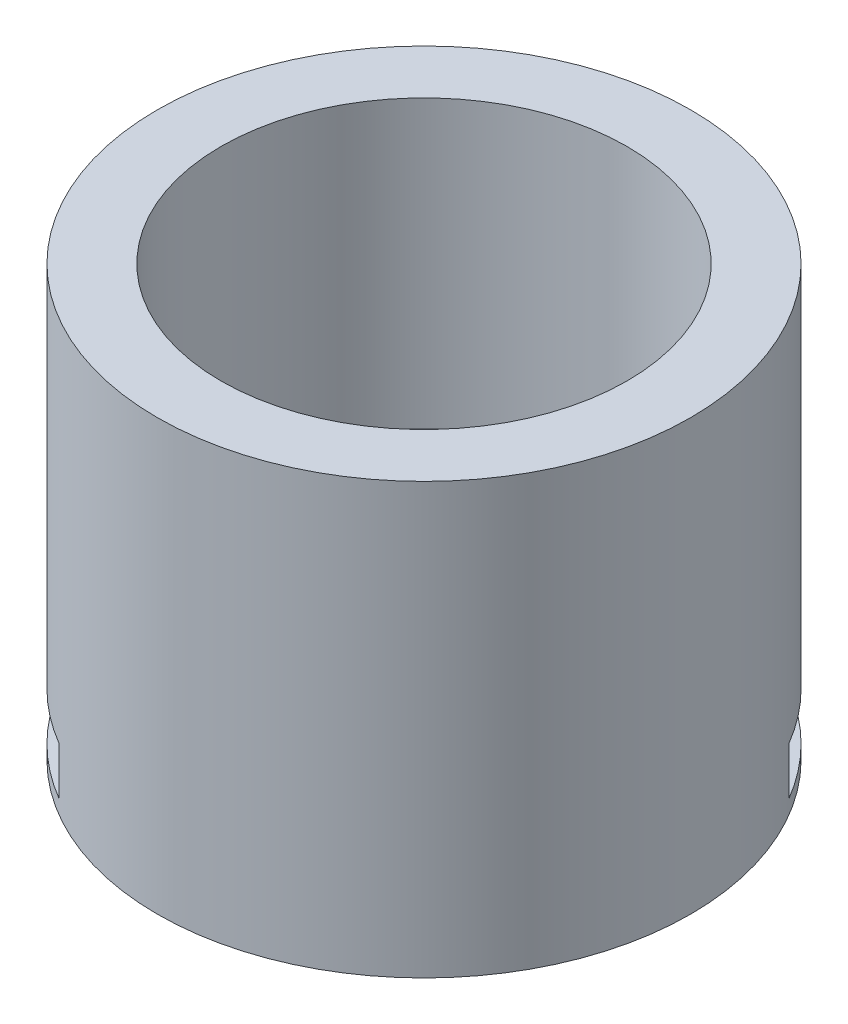
from build123d import *

# Parameters (mm, degrees)
SKETCH_1_R          = 27.9
EXTRUDE_1_DEPTH     = 45
SKETCH_2_R          = 21.25
CUT_EXTRUDE_1_DEPTH = 30
SKETCH_3_R          = 1.25
CUT_EXTRUDE_2_DEPTH = 6
SKETCH_7_W          = 5
SKETCH_7_H          = 14
CUT_EXTRUDE_3_DEPTH = 45
SKETCH_8_W          = 7
SKETCH_8_H          = 9
CUT_EXTRUDE_4_DEPTH = 90


with BuildPart() as part:
    # 草图1 → 凸台-拉伸1 (new body)
    with BuildSketch(Plane(origin=(0, 0, 0), x_dir=(1, 0, 0), z_dir=(0, 1, 0))):
        Circle(SKETCH_1_R)
    extrude(amount=EXTRUDE_1_DEPTH)

    # 草图2 → 切除-拉伸1 (cut)
    with BuildSketch(Plane(origin=(0, 45, 0), x_dir=(1, 0, 0), z_dir=(0, 1, 0))):
        Circle(SKETCH_2_R)
    extrude(amount=-CUT_EXTRUDE_1_DEPTH, mode=Mode.SUBTRACT)

    # 草图3 → 切除-拉伸2 (cut)
    with BuildSketch(Plane.XZ):
        with Locations((-19, 0)):
            Circle(SKETCH_3_R)
        with Locations((0, 19)):
            Circle(SKETCH_3_R)
        with Locations((19, 0)):
            Circle(SKETCH_3_R)
        with Locations((0, -19)):
            Circle(SKETCH_3_R)
    extrude(amount=-CUT_EXTRUDE_2_DEPTH, mode=Mode.SUBTRACT)

    # 草图7 → 切除-拉伸3 (cut, symmetric)
    with BuildSketch(Plane(origin=(0, 0, 0), x_dir=(0, 1, 0), z_dir=(0.7071067811865438, 0, -0.7071067811865512))):
        with Locations((4, 0)):
            Rectangle(SKETCH_7_W, SKETCH_7_H)
    extrude(amount=CUT_EXTRUDE_3_DEPTH, both=True, mode=Mode.SUBTRACT)

    # 草图8 → 切除-拉伸4 (cut)
    with BuildSketch(Plane(origin=(0, 0, 0), x_dir=(0, 1, 0), z_dir=(0.7071067811865488, 0, 0.7071067811865464))):
        with Locations((5, 0)):
            Rectangle(SKETCH_8_W, SKETCH_8_H)
    extrude(amount=-CUT_EXTRUDE_4_DEPTH, mode=Mode.SUBTRACT)


solid = part.part
